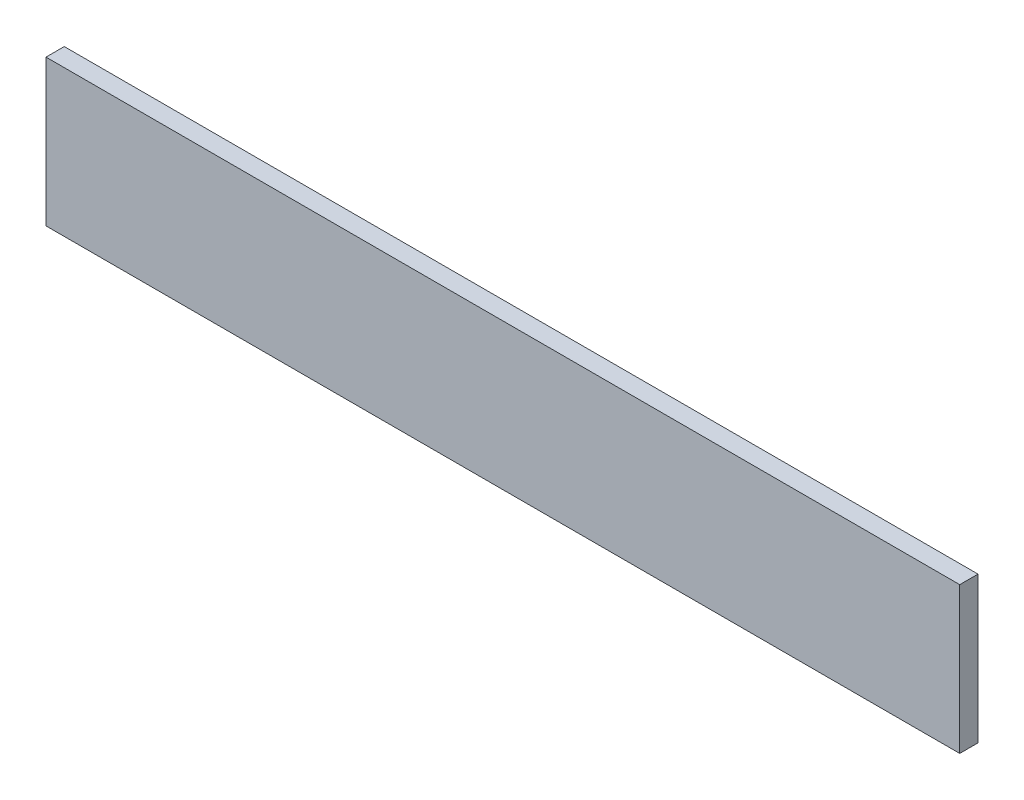
from build123d import *

# Parameters (mm, degrees)
SKETCH_1_W      = 250
SKETCH_1_H      = 40
EXTRUDE_1_DEPTH = 5


with BuildPart() as part:
    # ｽｹｯﾁ1 → ﾎﾞｽ - 押し出し1 (new body)
    with BuildSketch(Plane.XY):
        Rectangle(SKETCH_1_W, SKETCH_1_H)
    extrude(amount=EXTRUDE_1_DEPTH)


solid = part.part
